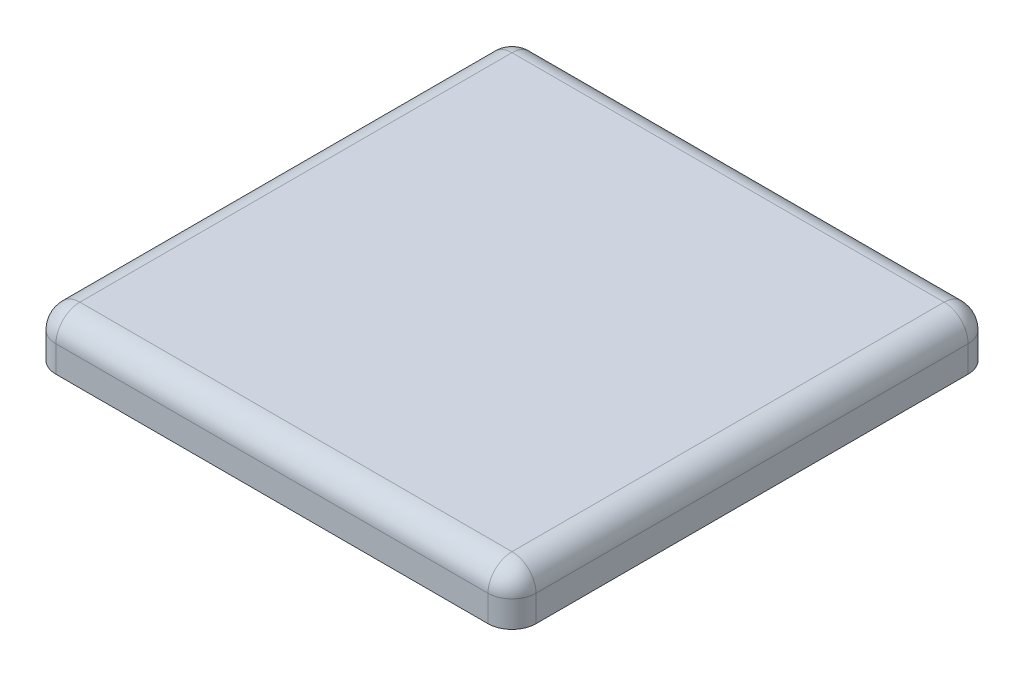
from build123d import *

# Parameters (mm, degrees)
AUFSATZ_LINEAR_AUSTRAGEN1_DEPTH = 4.2
VERRUNDUNG1_R                   = 2
SKIZZE2_R                       = 3.5
AUFSATZ_LINEAR_AUSTRAGEN2_DEPTH = 10
FASE1_SIZE                      = 3
FASE1_SIZE2                     = 1.091910703


with BuildPart() as part:
    # Skizze1 → Aufsatz-Linear austragen1 (new body)
    with BuildSketch(Plane(origin=(0, 0, 0), x_dir=(1, 0, 0), z_dir=(0, 1, 0))):
        with BuildLine():
            Line((-20, -18), (-20, 18))
            ThreePointArc((-20, 18), (-19.414213562, 19.414213562), (-18, 20))
            Line((-18, 20), (18, 20))
            ThreePointArc((18, 20), (19.414213562, 19.414213562), (20, 18))
            Line((20, 18), (20, -18))
            ThreePointArc((20, -18), (19.414213562, -19.414213562), (18, -20))
            Line((18, -20), (-18, -20))
            ThreePointArc((-18, -20), (-19.414213562, -19.414213562), (-20, -18))
        make_face()
    extrude(amount=AUFSATZ_LINEAR_AUSTRAGEN1_DEPTH)

    # Verrundung1
    verrundung1_edges = [part.edges().sort_by_distance(p)[0] for p in [
        (-19.414213562, 4.2, 19.414213562),
        (0, 4.2, 20),
        (19.414213562, 4.2, 19.414213562),
        (20, 4.2, 0),
        (19.414213562, 4.2, -19.414213562),
        (0, 4.2, -20),
        (-19.414213562, 4.2, -19.414213562),
        (-20, 4.2, 0),
    ]]
    fillet(verrundung1_edges, radius=VERRUNDUNG1_R)

    # Skizze2 → Aufsatz-Linear austragen2 (add)
    with BuildSketch(Plane.XZ):
        with Locations(Location((0, 0, 0), (0, 0, 90))):
            Circle(SKIZZE2_R)
    extrude(amount=AUFSATZ_LINEAR_AUSTRAGEN2_DEPTH)

    # Fase1
    fase1_edges = [part.edges().sort_by_distance(p)[0] for p in [
        (0, -10, -3.5),
    ]]
    fase1_side = [part.faces().sort_by_distance(p)[0] for p in [
        (0, -5, -3.5),
    ]]
    chamfer(fase1_edges, length=FASE1_SIZE, length2=FASE1_SIZE2, reference=fase1_side[0])


solid = part.part
